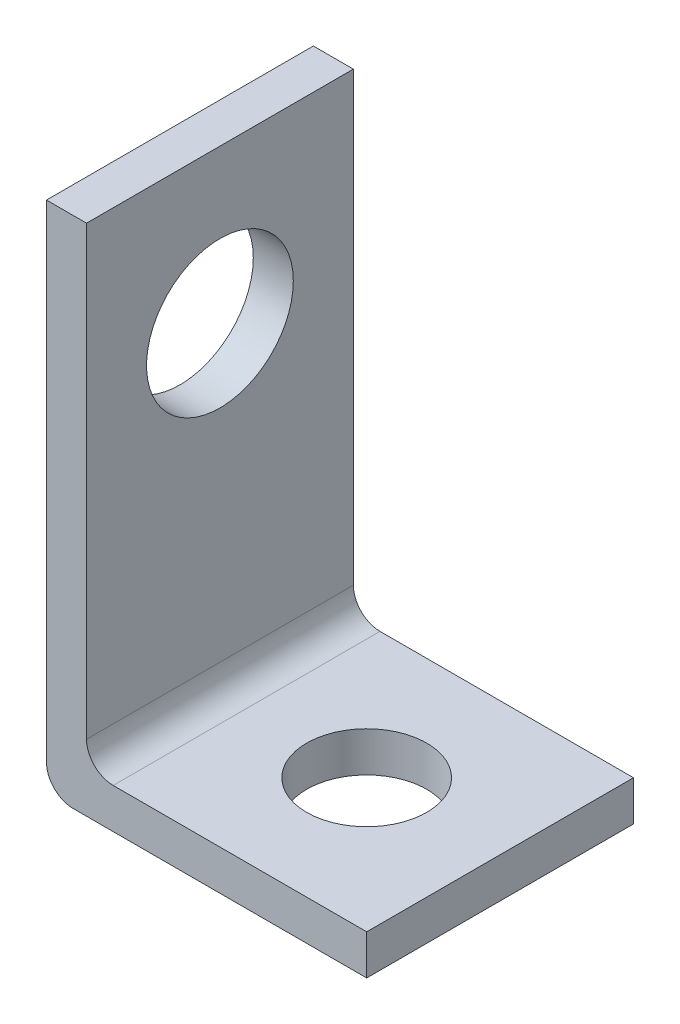
from build123d import *

# Parameters (mm, degrees)
BOSS_EXTRU_1_DEPTH              = 5
CONG_1_R                        = 1
DIAM_TRE_DU_PER_AGE_5_5_5_5_1_D = 5.5
D_GAGEMENT_M41_D                = 4.5


with BuildPart() as part:
    # Esquisse1 → Boss.-Extru.1 (new, symmetric)
    with BuildSketch(Plane.XY):
        Polygon((0, 0), (10.5, 0), (10.5, -1.5), (-1.5, -1.5), (-1.5, 17.75), (0, 17.75), align=None)
    extrude(amount=BOSS_EXTRU_1_DEPTH, both=True)

    # Congé1
    cong_1_edges = [part.edges().sort_by_distance(p)[0] for p in [
        (0, 0, 0),
        (-1.5, -1.5, 0),
    ]]
    fillet(cong_1_edges, radius=CONG_1_R)

    # Diamètre du perçage Ø5.5 (5.5)1 (through all)
    with Locations(Plane(origin=(0, 0, 0), x_dir=(0, 0, -1), z_dir=(1, 0, 0))):
        with Locations((0, 12)):
            Hole(DIAM_TRE_DU_PER_AGE_5_5_5_5_1_D / 2)

    # Dégagement M41 (through all)
    with Locations(Plane(origin=(0, 0, 0), x_dir=(1, 0, 0), z_dir=(0, 1, 0))):
        with Locations((5.5, 0)):
            Hole(D_GAGEMENT_M41_D / 2)


solid = part.part
